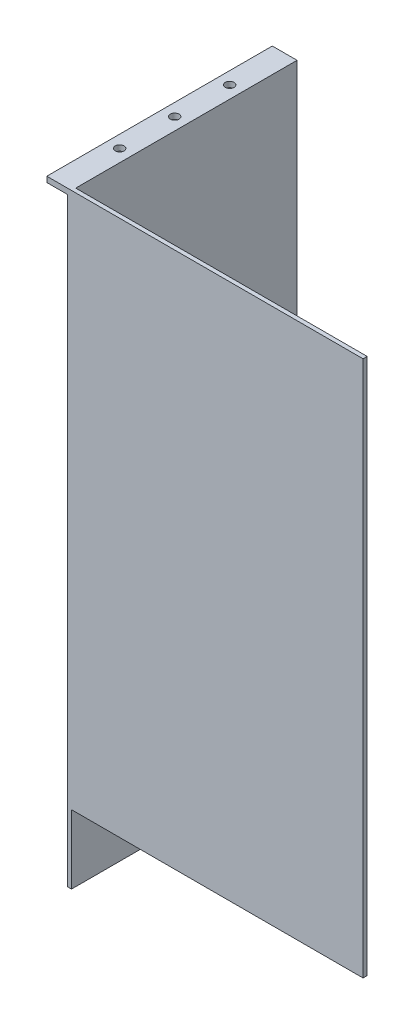
from build123d import *

# Parameters (mm, degrees)
SKETCH_1_W          = 106
SKETCH_1_H          = 195
EXTRUDE_1_DEPTH     = 1.5
SKETCH_2_W          = 82
SKETCH_2_H          = 220
EXTRUDE_2_DEPTH     = 1.5
SKETCH_3_W          = 82
SKETCH_3_H          = 2
EXTRUDE_3_DEPTH     = 9
SKETCH_5_R          = 1.6
CUT_EXTRUDE_1_DEPTH = 9


with BuildPart() as part:
    # 草图1 → 凸台-拉伸1 (new body)
    with BuildSketch(Plane.XY):
        with Locations((53, -97.5)):
            Rectangle(SKETCH_1_W, SKETCH_1_H)
    extrude(amount=EXTRUDE_1_DEPTH)

    # 草图2 → 凸台-拉伸2 (add)
    with BuildSketch(Plane.ZY):
        with Locations((-39.5, -110)):
            Rectangle(SKETCH_2_W, SKETCH_2_H)
    extrude(amount=EXTRUDE_2_DEPTH)

    # 草图3 → 凸台-拉伸3 (add)
    with BuildSketch(Plane.ZY):
        with Locations((-39.5, -1)):
            Rectangle(SKETCH_3_W, SKETCH_3_H)
    extrude(amount=EXTRUDE_3_DEPTH)

    # 草图5 → 切除-拉伸1 (cut)
    with BuildSketch(Plane(origin=(0, 0, 0), x_dir=(1, 0, 0), z_dir=(0, 1, 0))):
        with Locations(Location((-4.5, 60.5, 0), (0, 0, 270))):
            Circle(SKETCH_5_R)
        with Locations(Location((-4.5, 40.5, 0), (0, 0, 270))):
            Circle(SKETCH_5_R)
        with Locations(Location((-4.5, 20.5, 0), (0, 0, 270))):
            Circle(SKETCH_5_R)
    extrude(amount=-CUT_EXTRUDE_1_DEPTH, mode=Mode.SUBTRACT)


solid = part.part
